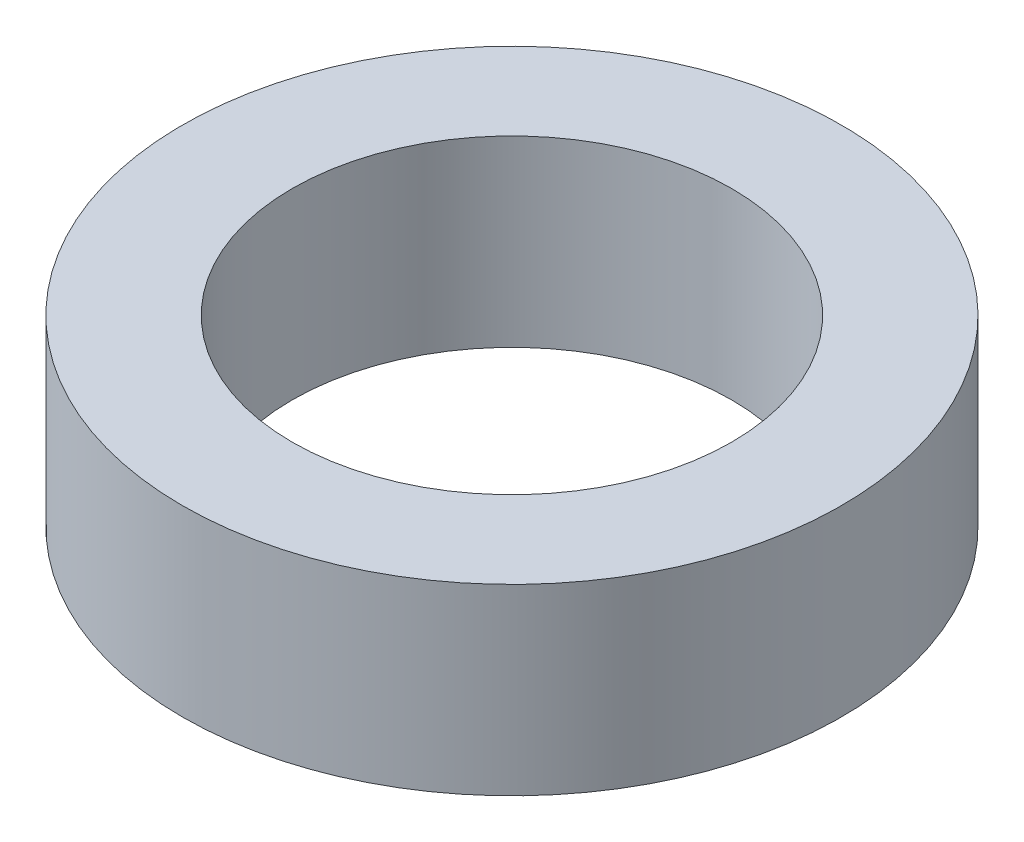
from build123d import *

# Parameters (mm, degrees)
SKETCH1_R           = 18
SKETCH1_R_2         = 12
BOSS_EXTRUDE1_DEPTH = 10


with BuildPart() as part:
    # Sketch1 → Boss-Extrude1 (new body)
    with BuildSketch(Plane(origin=(0, 0, 0), x_dir=(1, 0, 0), z_dir=(0, 1, 0))):
        with Locations(Location((0, 0, 0), (0, 0, 270))):
            Circle(SKETCH1_R)
        with Locations(Location((0, 0, 0), (0, 0, 270))):
            Circle(SKETCH1_R_2, mode=Mode.SUBTRACT)
    extrude(amount=BOSS_EXTRUDE1_DEPTH)


solid = part.part
